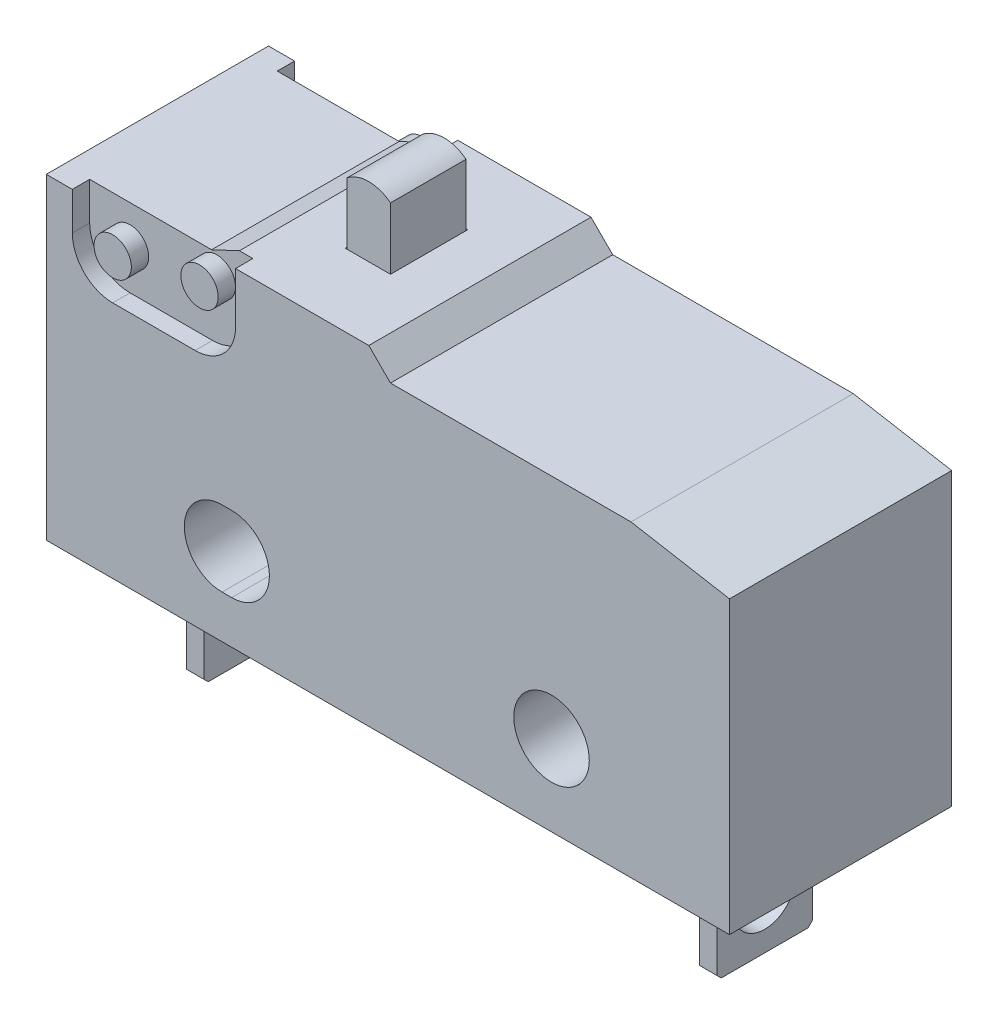
from build123d import *

# Parameters (mm, degrees)
SKETCH2_R          = 1.1049
EXTRUDE1_DEPTH     = 3.2512
EXTRUDE2_DEPTH     = 1.1049
SKETCH4_W          = 1.3208
SKETCH4_H          = 2.2606
CUT_EXTRUDE1_DEPTH = 1.016
SKETCH5_R          = 0.5461
CUT_EXTRUDE2_DEPTH = 0.508
SKETCH10_R         = 0.9017
EXTRUDE6_DEPTH     = 0.254
LPATTERN1_COUNT    = 2
LPATTERN1_PITCH    = 15.0114


with BuildPart() as part:
    # Sketch2 → Extrude1 (new, symmetric)
    with BuildSketch(Plane.XY):
        Polygon((9.9949, 8.509), (7.113888836, 9.017), (0.0762, 9.017), (-0.5588, 9.652), (-4.8514, 9.652), (-5.664596778, 9.271), (-9.9949, 9.271), (-9.9949, 0), (9.9949, 0), align=None)
        with Locations((4.7879, 2.3622)):
            Circle(SKETCH2_R, mode=Mode.SUBTRACT)
        with BuildLine():
            Line((-4.8514, 3.4671), (-4.572, 3.4671))
            ThreePointArc((-4.572, 3.4671), (-3.4671, 2.3622), (-4.572, 1.2573))
            Line((-4.572, 1.2573), (-4.8514, 1.2573))
            ThreePointArc((-4.8514, 1.2573), (-5.9563, 2.3622), (-4.8514, 3.4671))
        make_face(mode=Mode.SUBTRACT)
    extrude(amount=EXTRUDE1_DEPTH, both=True)

    # Sketch4 → Cut-Extrude1 (cut)
    with BuildSketch(Plane(origin=(0, 9.652, 0), x_dir=(-1, 0, 0), z_dir=(0, 1, 0))):
        with Locations((2.7051, 0)):
            Rectangle(SKETCH4_W, SKETCH4_H)
    extrude(amount=-CUT_EXTRUDE1_DEPTH, mode=Mode.SUBTRACT)

    # Sketch5 → Cut-Extrude2 (cut)
    with BuildSketch(Plane.XY.offset(3.2512)):
        with BuildLine():
            Line((-9.2329, 9.271), (-9.2329, 8.1661))
            ThreePointArc((-9.2329, 8.1661), (-8.886963819, 7.330936181), (-8.0518, 6.985))
            Line((-8.0518, 6.985), (-5.6388, 6.985))
            ThreePointArc((-5.6388, 6.985), (-4.803636181, 7.330936181), (-4.4577, 8.1661))
            Line((-4.4577, 8.1661), (-4.4577, 9.652))
            Line((-4.4577, 9.652), (-4.8514, 9.652))
            Line((-4.8514, 9.652), (-5.664596778, 9.271))
            Line((-5.664596778, 9.271), (-9.2329, 9.271))
        make_face()
        with Locations((-5.5118, 8.6741)):
            Circle(SKETCH5_R, mode=Mode.SUBTRACT)
        with Locations((-8.0518, 8.1661)):
            Circle(SKETCH5_R, mode=Mode.SUBTRACT)
    cut_extrude2 = extrude(amount=-CUT_EXTRUDE2_DEPTH, mode=Mode.SUBTRACT)

    # Mirror1: Cut-Extrude2 across plane
    add(cut_extrude2.mirror(Plane.XY), mode=Mode.SUBTRACT)

    # Sketch10 → Extrude6 (add, symmetric)
    with BuildSketch(Plane(origin=(-7.493, 0, 0), x_dir=(0, 0, -1), z_dir=(1, 0, 0))):
        Polygon((-1.397, 0), (-1.397, -3.0734), (-1.27, -3.2004), (1.27, -3.2004), (1.397, -3.0734), (1.397, 0), align=None)
        with Locations((0, -1.7018)):
            Circle(SKETCH10_R, mode=Mode.SUBTRACT)
    extrude6 = extrude(amount=EXTRUDE6_DEPTH, both=True)

    # LPattern1: Extrude6 ×2
    with Locations(*[(i * LPATTERN1_PITCH, 0, 0) for i in range(1, LPATTERN1_COUNT)]):
        add(extrude6)


with BuildPart() as body_2:
    # Sketch3 → Extrude2 (new, symmetric)
    with BuildSketch(Plane.XY):
        with BuildLine():
            Line((-3.3401, 9.271), (-3.3401, 11.435714746))
            ThreePointArc((-3.3401, 11.435714746), (-2.7051, 11.6586), (-2.0701, 11.435714746))
            Line((-2.0701, 11.435714746), (-2.0701, 9.271))
            Line((-2.0701, 9.271), (-3.3401, 9.271))
        make_face()
    extrude(amount=EXTRUDE2_DEPTH, both=True)


solid = Compound([part.part, body_2.part])
